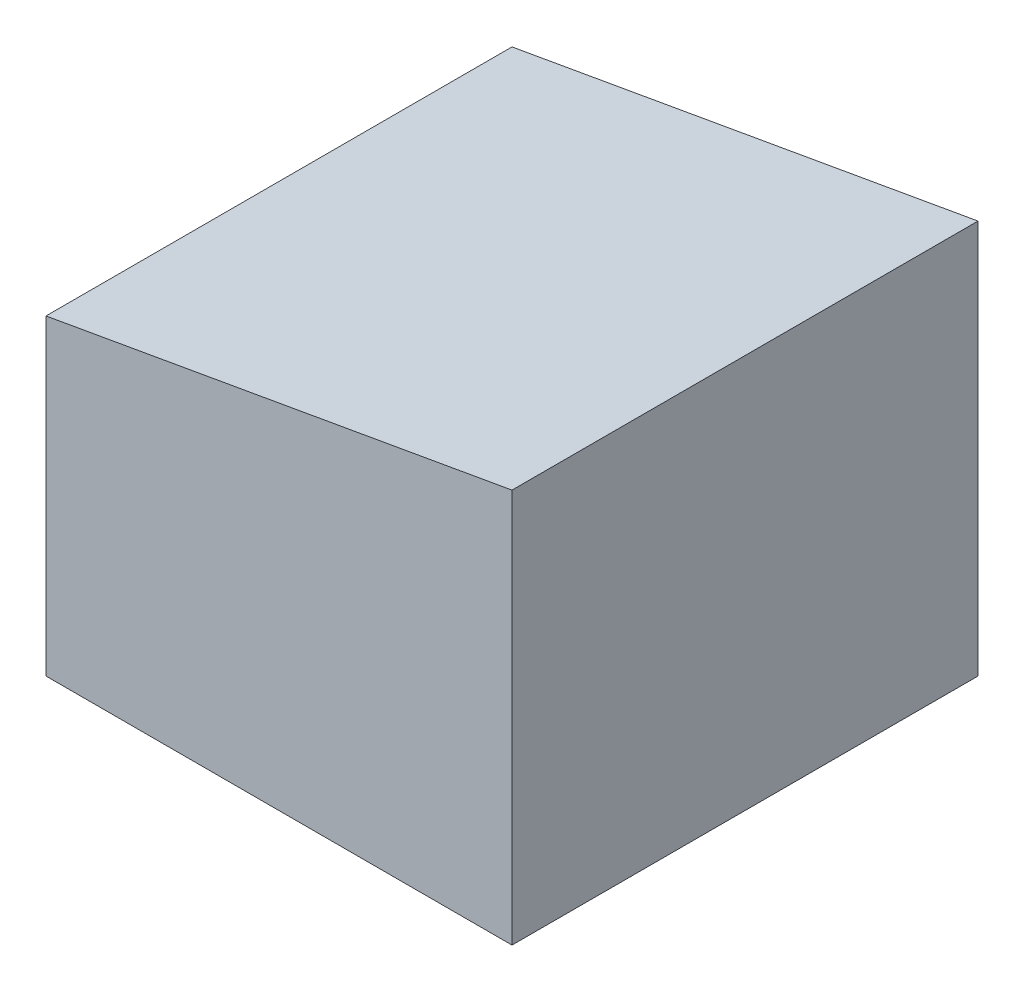
from build123d import *

# Parameters (mm, degrees)
BOSS_EXTRUDE1_DEPTH = 50.8


with BuildPart() as part:
    # Sketch1 → Boss-Extrude1 (new body)
    with BuildSketch(Plane.XY):
        Polygon((50.8, 42.95741062), (0, 34), (0, 0), (50.8, 0), align=None)
    extrude(amount=BOSS_EXTRUDE1_DEPTH)


solid = part.part
